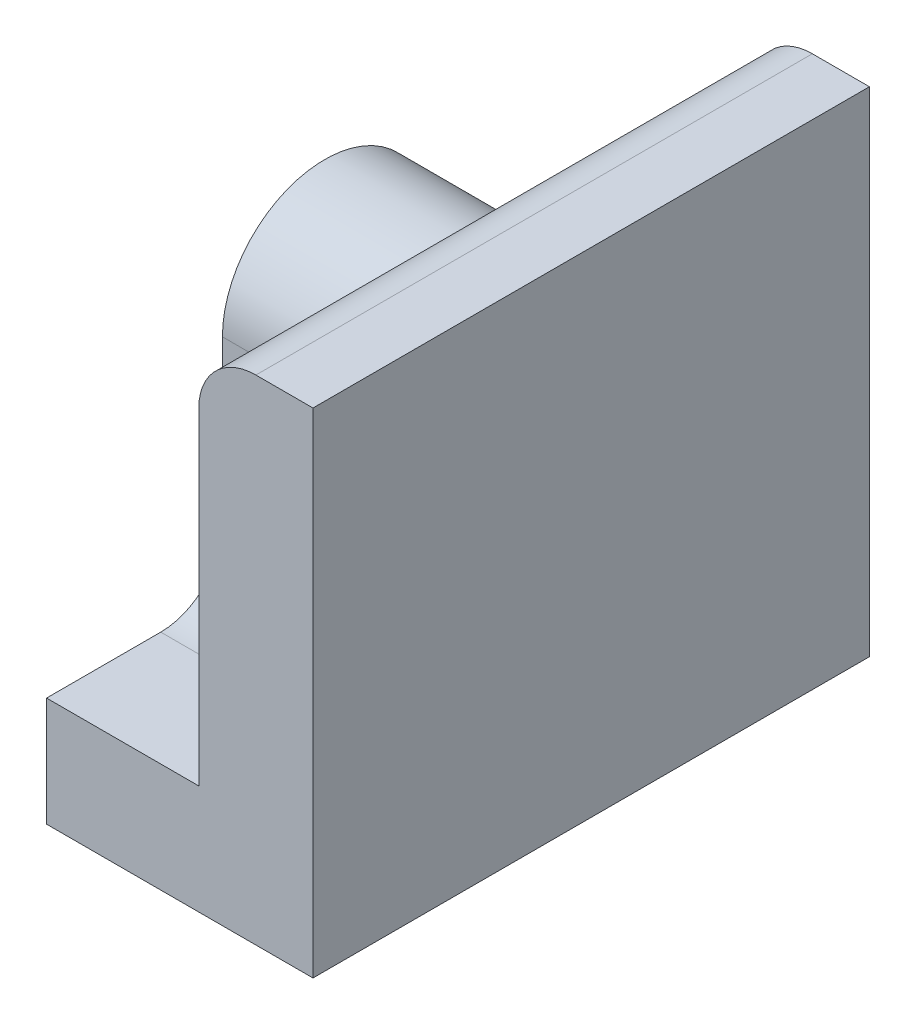
from build123d import *

# Parameters (mm, degrees)
BOSS_EXTRUDE1_DEPTH = 7
BOSS_EXTRUDE2_DEPTH = 3
CUT_EXTRUDE1_DEPTH  = 14.62


with BuildPart() as part:
    # Sketch1 → Boss-Extrude1 (new body)
    with BuildSketch(Plane(origin=(0, 0, 0), x_dir=(0, 0, -1), z_dir=(1, 0, 0))):
        with BuildLine():
            ThreePointArc((2.69, 5.91), (1.902117241, 7.812117241), (0, 8.6))
            Line((0, 8.6), (0, 0))
            Line((0, 0), (0, -2.87))
            Line((0, -2.87), (7.31, -2.87))
            Line((7.31, -2.87), (7.31, 0))
            Line((7.31, 0), (4.31, 0))
            ThreePointArc((4.31, 0), (3.164487014, 0.474487014), (2.69, 1.62))
            Line((2.69, 1.62), (2.69, 5.91))
        make_face()
    boss_extrude1 = extrude(amount=-BOSS_EXTRUDE1_DEPTH)

    # Sketch1<3> → Boss-Extrude2 (add)
    with BuildSketch(Plane(origin=(0, 0, 0), x_dir=(0, 0, -1), z_dir=(1, 0, 0))):
        with BuildLine():
            Line((7.31, 10.1), (0, 10.1))
            Line((0, 10.1), (0, 8.6))
            ThreePointArc((0, 8.6), (1.902117241, 7.812117241), (2.69, 5.91))
            Line((2.69, 5.91), (2.69, 1.62))
            ThreePointArc((2.69, 1.62), (3.164487014, 0.474487014), (4.31, 0))
            Line((4.31, 0), (7.31, 0))
            Line((7.31, 0), (7.31, 10.1))
        make_face()
    boss_extrude2 = extrude(amount=-BOSS_EXTRUDE2_DEPTH)

    # Mirror1: Boss-Extrude1, Boss-Extrude2 across plane
    add(boss_extrude1.mirror(Plane.XY))
    add(boss_extrude2.mirror(Plane.XY))

    # Sketch2 → Cut-Extrude1 (cut)
    with BuildSketch(Plane(origin=(0, 0, -7.31), x_dir=(-1, 0, 0), z_dir=(0, 0, -1))):
        with BuildLine():
            Line((3, 10.1), (1.5, 10.1))
            ThreePointArc((1.5, 10.1), (2.560660172, 9.660660172), (3, 8.6))
            Line((3, 8.6), (3, 10.1))
        make_face()
    extrude(amount=-CUT_EXTRUDE1_DEPTH, mode=Mode.SUBTRACT)


solid = part.part
